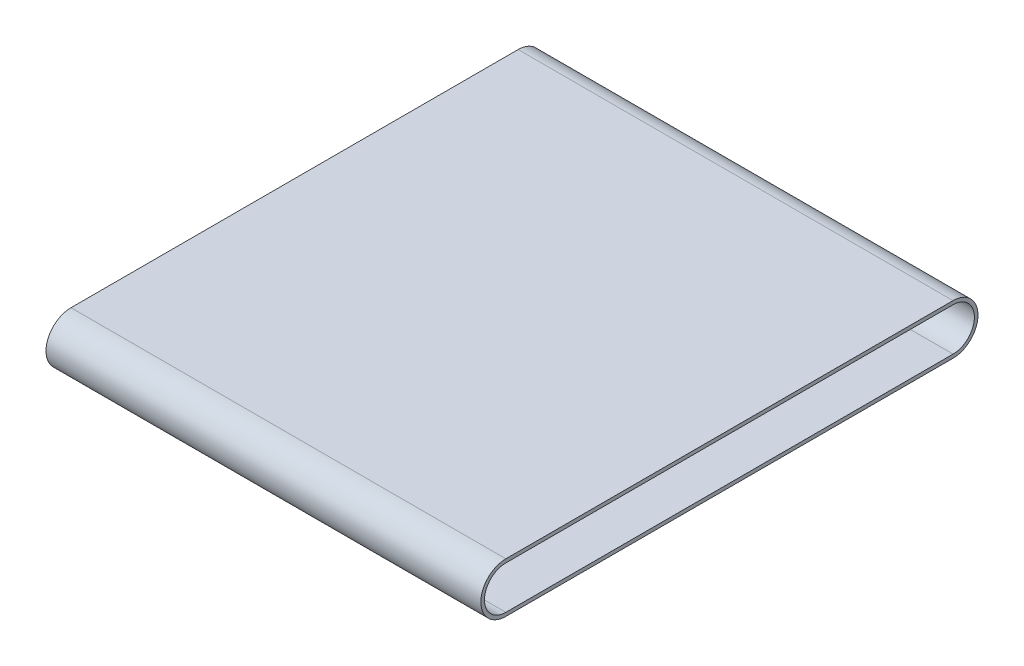
from build123d import *

# Parameters (mm, degrees)
BOSS_EXTRUDE1_DEPTH = 444.5


with BuildPart() as part:
    # Sketch1 → Boss-Extrude1 (new body)
    with BuildSketch(Plane(origin=(0, 0, 0), x_dir=(0, 0, -1), z_dir=(1, 0, 0))):
        with BuildLine():
            Line((0, 25.527), (457.073, 25.527))
            ThreePointArc((457.073, 25.527), (482.6, 0), (457.073, -25.527))
            Line((457.073, -25.527), (0, -25.527))
            ThreePointArc((0, -25.527), (-25.527, 0), (0, 25.527))
        make_face()
        with BuildLine():
            Line((0, 21.844), (457.073, 21.844))
            ThreePointArc((457.073, 21.844), (478.917, 0), (457.073, -21.844))
            Line((457.073, -21.844), (0, -21.844))
            ThreePointArc((0, -21.844), (-21.844, 0), (0, 21.844))
        make_face(mode=Mode.SUBTRACT)
    extrude(amount=BOSS_EXTRUDE1_DEPTH)


solid = part.part
